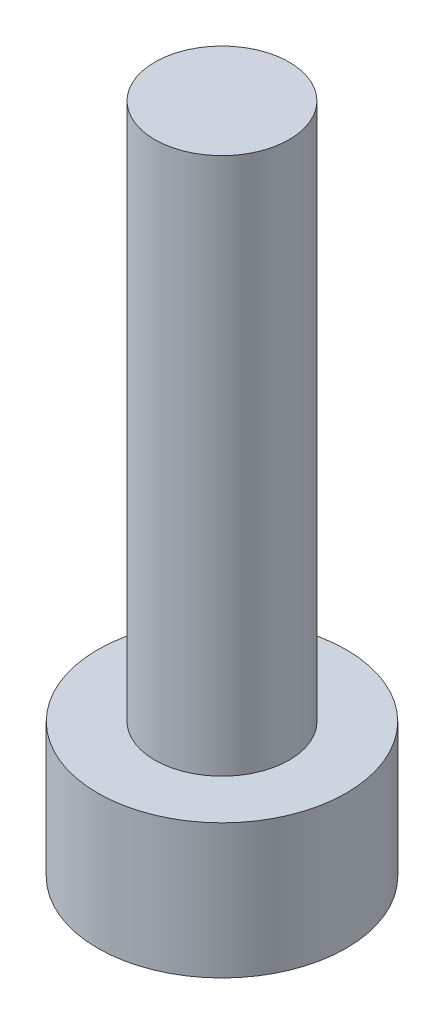
from build123d import *

# Parameters (mm, degrees)
SKETCH1_R           = 1.85
BOSS_EXTRUDE1_DEPTH = 2
SKETCH2_R           = 1
BOSS_EXTRUDE2_DEPTH = 8


with BuildPart() as part:
    # Sketch1 → Boss-Extrude1 (new body)
    with BuildSketch(Plane(origin=(0, 0, 0), x_dir=(1, 0, 0), z_dir=(0, 1, 0))):
        with Locations(Location((0, 0, 0), (0, 0, 270))):
            Circle(SKETCH1_R)
    extrude(amount=BOSS_EXTRUDE1_DEPTH)

    # Sketch2 → Boss-Extrude2 (add)
    with BuildSketch(Plane(origin=(0, 2, 0), x_dir=(1, 0, 0), z_dir=(0, 1, 0))):
        with Locations(Location((0, 0, 0), (0, 0, 270))):
            Circle(SKETCH2_R)
    extrude(amount=BOSS_EXTRUDE2_DEPTH)


solid = part.part
